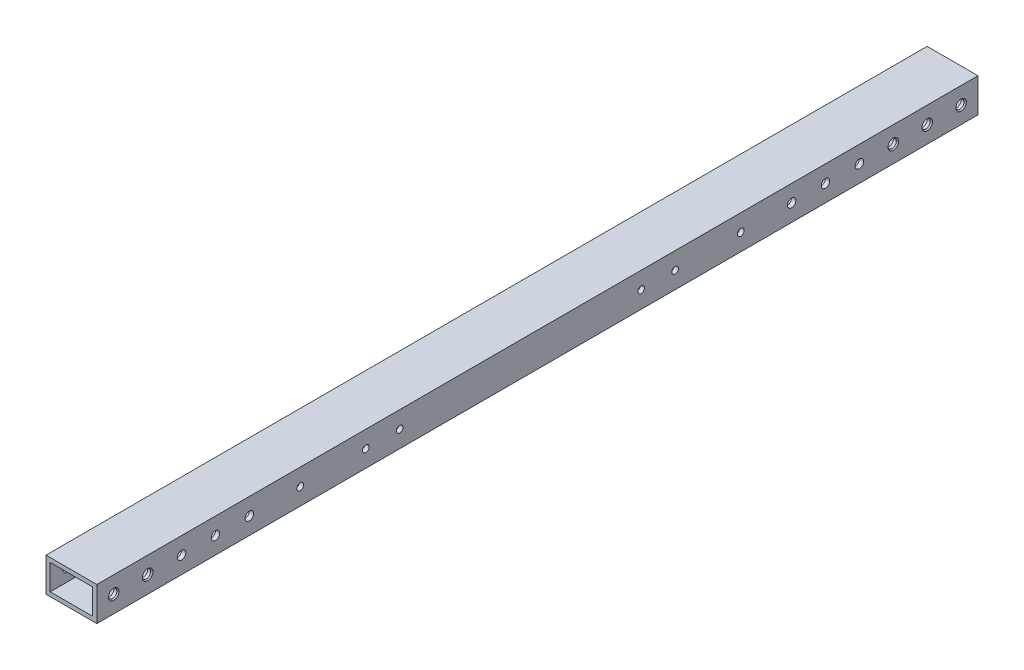
from build123d import *

# Parameters (mm, degrees)
BOSS_EXTRUDE1_DEPTH                  = 330.200001
BOSS_EXTRUDE1_DEPTH_BACK             = 330.200001
SKETCH3_W                            = 38.1
SKETCH3_H                            = 25.4
SKETCH3_W_2                          = 31.75
SKETCH3_H_2                          = 19.05
F_1_4_0_25_DIAMETER_HOLE2_AT_2_COUNT = 2
F_1_4_0_25_DIAMETER_HOLE2_AT_2_PITCH = 25.4
F_1_4_0_25_DIAMETER_HOLE2_AT_3_COUNT = 2
F_1_4_0_25_DIAMETER_HOLE2_AT_3_PITCH = 635.000000508
F_1_4_0_25_DIAMETER_HOLE2_AT_4_COUNT = 2
F_1_4_0_25_DIAMETER_HOLE2_AT_4_PITCH = 50.8
F_1_4_0_25_DIAMETER_HOLE2_AT_5_COUNT = 2
F_1_4_0_25_DIAMETER_HOLE2_AT_5_PITCH = 609.600000508
F_1_4_0_25_DIAMETER_HOLE3_D          = 6.35
F_13_64_0_20313_DIAMETER_HOLE1_D     = 5.159502
F_10_CLEARANCE_HOLE1_D               = 4.9784


with BuildPart() as part:
    # Sketch3 → Boss-Extrude1 (new, two sides: drawn at the far end of the back side and taken through both)
    with BuildSketch(Plane.XY.offset(-BOSS_EXTRUDE1_DEPTH_BACK)):
        Rectangle(SKETCH3_W, SKETCH3_H)
        Rectangle(SKETCH3_W_2, SKETCH3_H_2, mode=Mode.SUBTRACT)
    extrude(amount=BOSS_EXTRUDE1_DEPTH + BOSS_EXTRUDE1_DEPTH_BACK)

    # Sketch8 → 1/4 (0.25) Diameter Hole2 (revolve, cut)
    with BuildSketch(Plane(origin=(-19.05, 0, -317.500000508), x_dir=(0, 0, 1), z_dir=(0, 1, 0))):
        Polygon((0, 0), (0, 38.1), (3.9624, 38.1), (3.175, 37.194199916), (3.175, 0), align=None)
    f_1_4_0_25_diameter_hole2 = revolve(axis=Axis((-25.4, 0, -317.500000508), (1, 0, 0)), mode=Mode.SUBTRACT)

    # 1/4 (0.25) Diameter Hole2 at 2: 1/4 (0.25) Diameter Hole2 ×2
    with Locations(*[(0, 0, i * F_1_4_0_25_DIAMETER_HOLE2_AT_2_PITCH) for i in range(1, F_1_4_0_25_DIAMETER_HOLE2_AT_2_COUNT)]):
        add(f_1_4_0_25_diameter_hole2, mode=Mode.SUBTRACT)

    # 1/4 (0.25) Diameter Hole2 at 3: 1/4 (0.25) Diameter Hole2 ×2
    with Locations(*[(0, 0, i * F_1_4_0_25_DIAMETER_HOLE2_AT_3_PITCH) for i in range(1, F_1_4_0_25_DIAMETER_HOLE2_AT_3_COUNT)]):
        add(f_1_4_0_25_diameter_hole2, mode=Mode.SUBTRACT)

    # 1/4 (0.25) Diameter Hole2 at 4: 1/4 (0.25) Diameter Hole2 ×2
    with Locations(*[(0, 0, i * F_1_4_0_25_DIAMETER_HOLE2_AT_4_PITCH) for i in range(1, F_1_4_0_25_DIAMETER_HOLE2_AT_4_COUNT)]):
        add(f_1_4_0_25_diameter_hole2, mode=Mode.SUBTRACT)

    # 1/4 (0.25) Diameter Hole2 at 5: 1/4 (0.25) Diameter Hole2 ×2
    with Locations(*[(0, 0, i * F_1_4_0_25_DIAMETER_HOLE2_AT_5_PITCH) for i in range(1, F_1_4_0_25_DIAMETER_HOLE2_AT_5_COUNT)]):
        add(f_1_4_0_25_diameter_hole2, mode=Mode.SUBTRACT)

    # 1/4 (0.25) Diameter Hole3 (through all)
    with Locations(Plane(origin=(19.05, 0, 0), x_dir=(0, 0, -1), z_dir=(1, 0, 0))):
        with Locations((-266.7, 0), (-241.3, 0), (-215.9, 0), (241.300000508, 0), (215.900000508, 0), (190.500000508, 0)):
            Hole(F_1_4_0_25_DIAMETER_HOLE3_D / 2)

    # 13/64 (0.20313) Diameter Hole1 (through all)
    with Locations(Plane(origin=(19.05, 0, 0), x_dir=(0, 0, -1), z_dir=(1, 0, 0))):
        with Locations((152.4, 0), (-177.8, 0)):
            Hole(F_13_64_0_20313_DIAMETER_HOLE1_D / 2)

    # #10 Clearance Hole1 (through all)
    with Locations(Plane(origin=(19.05, 0, 0), x_dir=(0, 0, -1), z_dir=(1, 0, 0))):
        with Locations((-128.587499997, -1.018e-06), (-103.187499997, -1.018e-06), (77.787500508, 0), (103.187500508, 0)):
            Hole(F_10_CLEARANCE_HOLE1_D / 2)


solid = part.part
